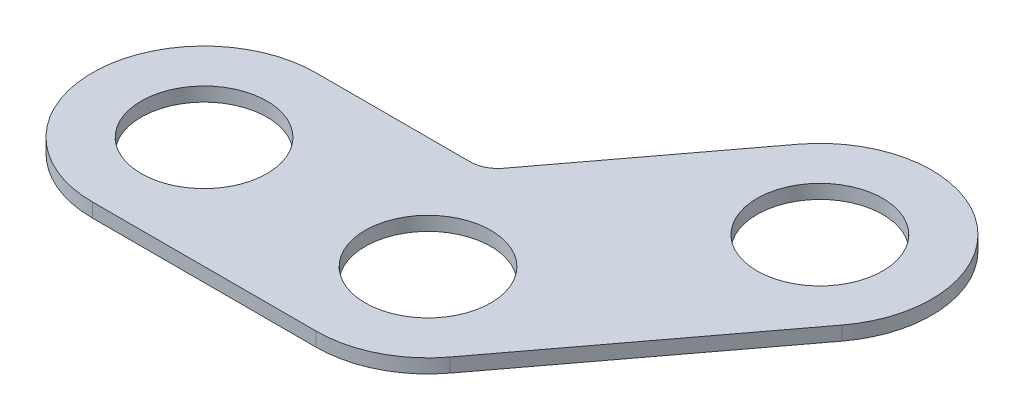
from build123d import *

# Parameters (mm, degrees)
SKETCH1_R           = 14.2875
BOSS_EXTRUDE1_DEPTH = 3.175
FILLET2_R           = 6.35


with BuildPart() as part:
    # Sketch1 → Boss-Extrude1 (new body)
    with BuildSketch(Plane(origin=(0, 0, 0), x_dir=(1, 0, 0), z_dir=(0, 1, 0))):
        with BuildLine():
            Line((71.172208723, -15.271936024), (109.397864591, 35.52897381))
            ThreePointArc((109.397864591, 35.52897381), (104.373791891, 71.096918557), (68.805847145, 66.072845858))
            Line((68.805847145, 66.072845858), (38.201154945, 25.4))
            Line((38.201154945, 25.4), (0, 25.4))
            ThreePointArc((0, 25.4), (-25.4, 0), (0, -25.4))
            Line((0, -25.4), (50.8762, -25.4))
            ThreePointArc((50.8762, -25.4), (62.217558494, -22.727375288), (71.172208723, -15.271936024))
        make_face()
        with Locations(Location((89.101855868, 50.800909834, 0), (0, 0, 270))):
            Circle(SKETCH1_R, mode=Mode.SUBTRACT)
        with Locations(Location((50.8762, 0, 0), (0, 0, 270))):
            Circle(SKETCH1_R, mode=Mode.SUBTRACT)
        with Locations(Location((0, 0, 0), (0, 0, 270))):
            Circle(SKETCH1_R, mode=Mode.SUBTRACT)
    extrude(amount=BOSS_EXTRUDE1_DEPTH)

    # Fillet2
    fillet2_edges = [part.edges().sort_by_distance(p)[0] for p in [
        (38.201154945, 1.5875, -25.4),
    ]]
    fillet(fillet2_edges, radius=FILLET2_R)


solid = part.part
